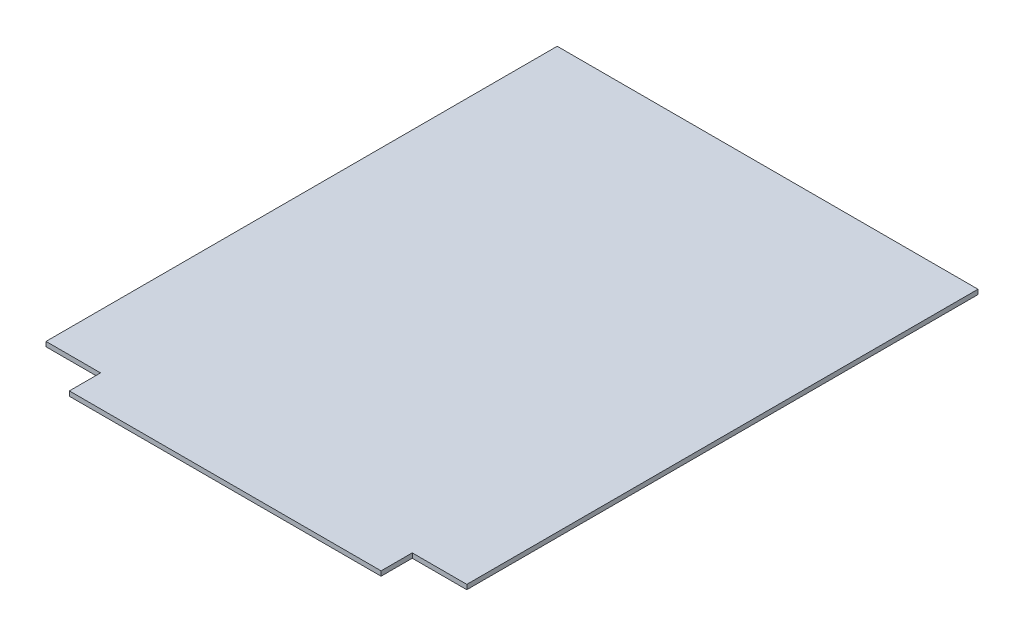
from build123d import *

# Parameters (mm, degrees)
SKETCH1_W           = 200
SKETCH1_H           = 20
SKETCH1_W_2         = 270
SKETCH1_H_2         = 328
BOSS_EXTRUDE1_DEPTH = 3


with BuildPart() as part:
    # Sketch1 → Boss-Extrude1 (new body)
    with BuildSketch(Plane(origin=(0, 0, 0), x_dir=(1, 0, 0), z_dir=(0, 1, 0))):
        with Locations((0, -174)):
            Rectangle(SKETCH1_W, SKETCH1_H)
        Rectangle(SKETCH1_W_2, SKETCH1_H_2)
    extrude(amount=BOSS_EXTRUDE1_DEPTH)


solid = part.part
